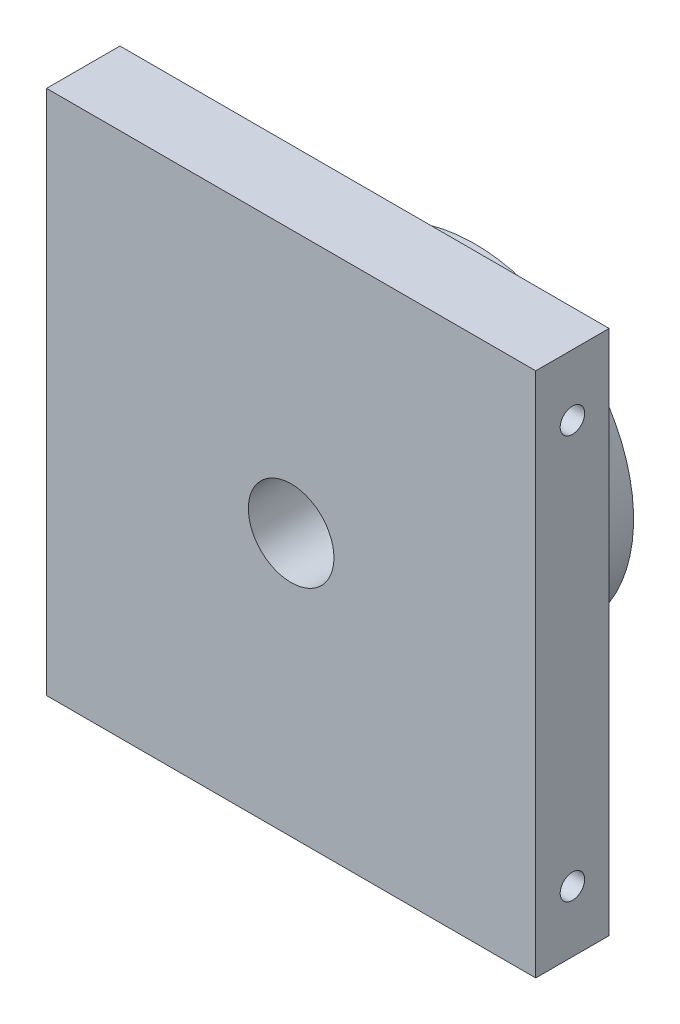
from build123d import *

# Parameters (mm, degrees)
SKETCH_1_W          = 40
SKETCH_1_H          = 43
SKETCH_1_R          = 1.5
EXTRUDE_1_DEPTH     = 6
CUT_EXTRUDE_1_DEPTH = 46.806658905
SKETCH_3_R          = 13
EXTRUDE_2_DEPTH     = 4
SKETCH_4_R          = 13
SKETCH_4_R_2        = 12.2
EXTRUDE_3_DEPTH     = 5
SKETCH_5_R          = 3.5
CUT_EXTRUDE_2_DEPTH = 33.973474188


with BuildPart() as part:
    # 草图1 → 凸台-拉伸1 (new body)
    with BuildSketch(Plane.XY):
        Rectangle(SKETCH_1_W, SKETCH_1_H)
        Circle(SKETCH_1_R, mode=Mode.SUBTRACT)
    extrude(amount=EXTRUDE_1_DEPTH)

    # 草图2 → 切除-拉伸1 (cut, through all)
    with BuildSketch(Plane(origin=(20, 0, 0), x_dir=(0, 0, -1), z_dir=(1, 0, 0))):
        with BuildLine():
            ThreePointArc((-2, 16.5), (-2.292893219, 17.207106781), (-3, 17.5))
            Line((-3, 17.5), (-3, 15.5))
            ThreePointArc((-3, 15.5), (-2.292893219, 15.792893219), (-2, 16.5))
        make_face()
        with BuildLine():
            Line((-3, 15.5), (-3, 17.5))
            ThreePointArc((-3, 17.5), (-4, 16.5), (-3, 15.5))
        make_face()
        with BuildLine():
            ThreePointArc((-2, -16.5), (-2.292893219, -15.792893219), (-3, -15.5))
            Line((-3, -15.5), (-3, -17.5))
            ThreePointArc((-3, -17.5), (-2.292893219, -17.207106781), (-2, -16.5))
        make_face()
        with BuildLine():
            Line((-3, -17.5), (-3, -15.5))
            ThreePointArc((-3, -15.5), (-4, -16.5), (-3, -17.5))
        make_face()
    extrude(amount=-CUT_EXTRUDE_1_DEPTH, mode=Mode.SUBTRACT)

    # 草图3 → 凸台-拉伸2 (add)
    with BuildSketch(Plane(origin=(0, 0, 0), x_dir=(-1, 0, 0), z_dir=(0, 0, -1))):
        Circle(SKETCH_3_R)
    extrude(amount=EXTRUDE_2_DEPTH)

    # 草图4 → 凸台-拉伸3 (add)
    with BuildSketch(Plane(origin=(0, 0, -4), x_dir=(-1, 0, 0), z_dir=(0, 0, -1))):
        Circle(SKETCH_4_R)
        Circle(SKETCH_4_R_2, mode=Mode.SUBTRACT)
    extrude(amount=EXTRUDE_3_DEPTH)

    # 草图5 → 切除-拉伸2 (cut, through all)
    with BuildSketch(Plane.XY.offset(6)):
        Circle(SKETCH_5_R)
    extrude(amount=-CUT_EXTRUDE_2_DEPTH, mode=Mode.SUBTRACT)


solid = part.part
